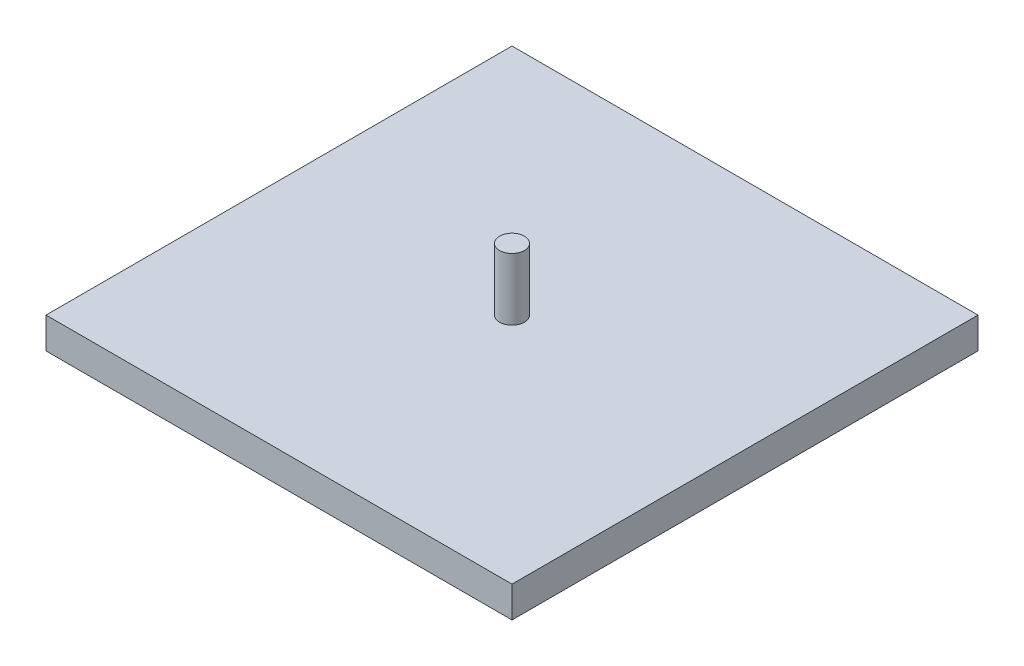
from build123d import *

# Parameters (mm, degrees)
SKETCH1_W           = 150
SKETCH1_H           = 150
BOSS_EXTRUDE1_DEPTH = 10
SKETCH4_R           = 4
BOSS_EXTRUDE3_DEPTH = 20


with BuildPart() as part:
    # Sketch1 → Boss-Extrude1 (new body)
    with BuildSketch(Plane(origin=(0, 0, 0), x_dir=(1, 0, 0), z_dir=(0, 1, 0))):
        with Locations((38.018383893, -46.403750336)):
            Rectangle(SKETCH1_W, SKETCH1_H)
    extrude(amount=BOSS_EXTRUDE1_DEPTH)

    # Sketch4 → Boss-Extrude3 (add)
    with BuildSketch(Plane(origin=(0, 10, 0), x_dir=(1, 0, 0), z_dir=(0, 1, 0))):
        with Locations(Location((38.018383893, -46.403750336, 0), (0, 0, 270))):
            Circle(SKETCH4_R)
    extrude(amount=BOSS_EXTRUDE3_DEPTH)


solid = part.part
